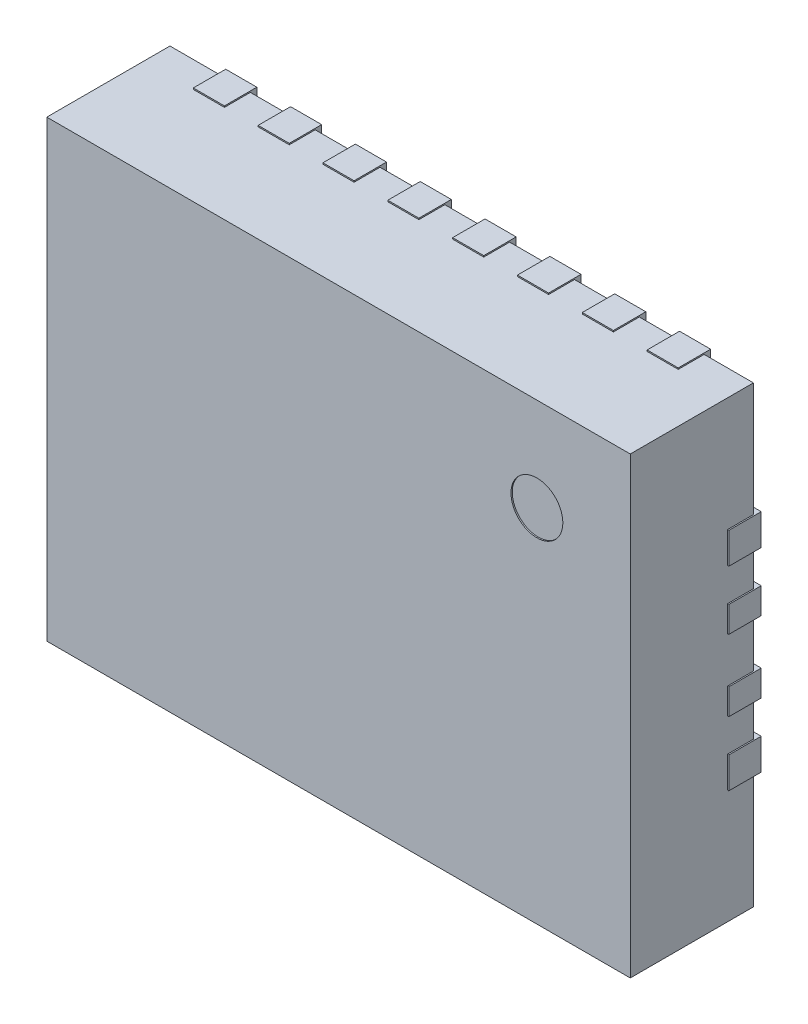
from build123d import *

# Parameters (mm, degrees)
SKETCH1_W                = 4.5
SKETCH1_H                = 3.5
BOSS_EXTRUDE1_DEPTH      = 0.95
SKETCH2_R                = 0.2
CUT_EXTRUDE1_DEPTH       = 0.01
BOSS_EXTRUDE2_DEPTH      = 0.05
BOSS_EXTRUDE2_DEPTH_BACK = 0.2
SKETCH3_W                = 0.01
SKETCH3_H                = 0.2
BOSS_EXTRUDE3_START      = -0.2
BOSS_EXTRUDE3_DEPTH      = 0.25
LPATTERN1_COUNT          = 2
LPATTERN1_PITCH          = 1.5
MIRROR1_START            = -0.2
MIRROR1_COPY_1_DEPTH     = 0.25
BOSS_EXTRUDE4_START      = -0.2
BOSS_EXTRUDE4_DEPTH      = 0.25
LPATTERN2_COUNT          = 8
LPATTERN2_PITCH          = 0.5
MIRROR2_START            = -0.2
MIRROR2_COPY_1_DEPTH     = 0.25
MIRROR2_COPY_2_DEPTH     = 0.25
MIRROR2_COPY_3_DEPTH     = 0.25
MIRROR2_COPY_4_DEPTH     = 0.25
MIRROR2_COPY_5_DEPTH     = 0.25
MIRROR2_COPY_6_DEPTH     = 0.25
MIRROR2_COPY_7_DEPTH     = 0.25


with BuildPart() as part:
    # Sketch1 → Boss-Extrude1 (new body)
    with BuildSketch(Plane.XY):
        Rectangle(SKETCH1_W, SKETCH1_H)
    extrude(amount=BOSS_EXTRUDE1_DEPTH)

    # Sketch2 → Cut-Extrude1 (cut)
    with BuildSketch(Plane.XY.offset(0.95)):
        with Locations((1.53, 1.03)):
            Circle(SKETCH2_R)
    extrude(amount=-CUT_EXTRUDE1_DEPTH, mode=Mode.SUBTRACT)

    # Sketch3 → Boss-Extrude2 (add, two sides: drawn at the far end of the back side and taken through both)
    with BuildSketch(Plane(origin=(0, 0, 0), x_dir=(-1, 0, 0), z_dir=(0, 0, -1)).offset(-BOSS_EXTRUDE2_DEPTH_BACK)):
        with BuildLine():
            Line((2.25, 0.375), (1.525, 0.375))
            Line((1.525, 0.375), (1.525, 0.9995))
            ThreePointArc((1.525, 0.9995), (1.517531223, 1.017531223), (1.4995, 1.025))
            Line((1.4995, 1.025), (-1.175, 1.025))
            Line((-1.175, 1.025), (-1.525, 0.675))
            Line((-1.525, 0.675), (-1.525, 0.375))
            Line((-1.525, 0.375), (-2.25, 0.375))
            Line((-2.25, 0.375), (-2.25, 0.175))
            Line((-2.25, 0.175), (-1.87, 0.175))
            Line((-1.87, 0.175), (-1.87, -0.175))
            Line((-1.87, -0.175), (-2.25, -0.175))
            Line((-2.25, -0.175), (-2.25, -0.375))
            Line((-2.25, -0.375), (-1.525, -0.375))
            Line((-1.525, -0.375), (-1.525, -0.9995))
            ThreePointArc((-1.525, -0.9995), (-1.517531223, -1.017531223), (-1.4995, -1.025))
            Line((-1.4995, -1.025), (1.4995, -1.025))
            ThreePointArc((1.4995, -1.025), (1.517531223, -1.017531223), (1.525, -0.9995))
            Line((1.525, -0.9995), (1.525, -0.375))
            Line((1.525, -0.375), (2.25, -0.375))
            Line((2.25, -0.375), (2.25, -0.175))
            Line((2.25, -0.175), (1.87, -0.175))
            Line((1.87, -0.175), (1.87, 0.175))
            Line((1.87, 0.175), (2.25, 0.175))
            Line((2.25, 0.175), (2.25, 0.375))
        make_face()
        with Locations((2.255, 0.275)):
            Rectangle(SKETCH3_W, SKETCH3_H)
        with Locations((2.255, -0.275)):
            Rectangle(SKETCH3_W, SKETCH3_H)
        with Locations((-2.255, -0.275)):
            Rectangle(SKETCH3_W, SKETCH3_H)
        with Locations((-2.255, 0.275)):
            Rectangle(SKETCH3_W, SKETCH3_H)
    extrude(amount=BOSS_EXTRUDE2_DEPTH + BOSS_EXTRUDE2_DEPTH_BACK)

    # Sketch5 → Boss-Extrude3 (add)
    with BuildSketch(Plane(origin=(0, 0, 0), x_dir=(-1, 0, 0), z_dir=(0, 0, -1)).offset(BOSS_EXTRUDE3_START)):
        with BuildLine():
            Line((1.97, 0.87), (2.25, 0.87))
            Line((2.25, 0.87), (2.26, 0.87))
            Line((2.26, 0.87), (2.26, 0.63))
            Line((2.26, 0.63), (2.25, 0.63))
            Line((2.25, 0.63), (1.97, 0.63))
            ThreePointArc((1.97, 0.63), (1.85, 0.75), (1.97, 0.87))
        make_face()
    boss_extrude3 = extrude(amount=BOSS_EXTRUDE3_DEPTH)

    # LPattern1: Boss-Extrude3 ×2
    with Locations(*[(0, -i * LPATTERN1_PITCH, 0) for i in range(1, LPATTERN1_COUNT)]):
        add(boss_extrude3)

    # Mirror1: Boss-Extrude3 across plane
    add(boss_extrude3.mirror(Plane(origin=(0, 0, 0), x_dir=(0, 0, 1), z_dir=(1, 0, 0))))

    # Mirror1 copy 1 sketch → Mirror1 copy 1 (add)
    with BuildSketch(Plane(origin=(0, -1.5, 0), x_dir=(1, 0, 0), z_dir=(0, 0, -1)).offset(MIRROR1_START)):
        with BuildLine():
            Line((1.97, -0.87), (2.25, -0.87))
            Line((2.25, -0.87), (2.26, -0.87))
            Line((2.26, -0.87), (2.26, -0.63))
            Line((2.26, -0.63), (2.25, -0.63))
            Line((2.25, -0.63), (1.97, -0.63))
            ThreePointArc((1.97, -0.63), (1.85, -0.75), (1.97, -0.87))
        make_face()
    extrude(amount=MIRROR1_COPY_1_DEPTH)

    # Sketch6 → Boss-Extrude4 (add)
    with BuildSketch(Plane(origin=(0, 0, 0), x_dir=(-1, 0, 0), z_dir=(0, 0, -1)).offset(BOSS_EXTRUDE4_START)):
        with BuildLine():
            Line((-1.87, 1.76), (-1.63, 1.76))
            Line((-1.63, 1.76), (-1.63, 1.75))
            Line((-1.63, 1.75), (-1.63, 1.47))
            ThreePointArc((-1.63, 1.47), (-1.75, 1.35), (-1.87, 1.47))
            Line((-1.87, 1.47), (-1.87, 1.75))
            Line((-1.87, 1.75), (-1.87, 1.76))
        make_face()
    boss_extrude4 = extrude(amount=BOSS_EXTRUDE4_DEPTH)

    # LPattern2: Boss-Extrude4 ×8
    with Locations(*[(-i * LPATTERN2_PITCH, 0, 0) for i in range(1, LPATTERN2_COUNT)]):
        add(boss_extrude4)

    # Mirror2: Boss-Extrude4 across plane
    add(boss_extrude4.mirror(Plane.ZX))

    # Mirror2 copy 1 sketch → Mirror2 copy 1 (add)
    with BuildSketch(Plane(origin=(-0.5, 0, 0), x_dir=(-1, 0, 0), z_dir=(0, 0, -1)).offset(MIRROR2_START)):
        with BuildLine():
            Line((-1.87, -1.76), (-1.63, -1.76))
            Line((-1.63, -1.76), (-1.63, -1.75))
            Line((-1.63, -1.75), (-1.63, -1.47))
            ThreePointArc((-1.63, -1.47), (-1.75, -1.35), (-1.87, -1.47))
            Line((-1.87, -1.47), (-1.87, -1.75))
            Line((-1.87, -1.75), (-1.87, -1.76))
        make_face()
    extrude(amount=MIRROR2_COPY_1_DEPTH)

    # Mirror2 copy 2 sketch → Mirror2 copy 2 (add)
    with BuildSketch(Plane(origin=(-1, 0, 0), x_dir=(-1, 0, 0), z_dir=(0, 0, -1)).offset(MIRROR2_START)):
        with BuildLine():
            Line((-1.87, -1.76), (-1.63, -1.76))
            Line((-1.63, -1.76), (-1.63, -1.75))
            Line((-1.63, -1.75), (-1.63, -1.47))
            ThreePointArc((-1.63, -1.47), (-1.75, -1.35), (-1.87, -1.47))
            Line((-1.87, -1.47), (-1.87, -1.75))
            Line((-1.87, -1.75), (-1.87, -1.76))
        make_face()
    extrude(amount=MIRROR2_COPY_2_DEPTH)

    # Mirror2 copy 3 sketch → Mirror2 copy 3 (add)
    with BuildSketch(Plane(origin=(-1.5, 0, 0), x_dir=(-1, 0, 0), z_dir=(0, 0, -1)).offset(MIRROR2_START)):
        with BuildLine():
            Line((-1.87, -1.76), (-1.63, -1.76))
            Line((-1.63, -1.76), (-1.63, -1.75))
            Line((-1.63, -1.75), (-1.63, -1.47))
            ThreePointArc((-1.63, -1.47), (-1.75, -1.35), (-1.87, -1.47))
            Line((-1.87, -1.47), (-1.87, -1.75))
            Line((-1.87, -1.75), (-1.87, -1.76))
        make_face()
    extrude(amount=MIRROR2_COPY_3_DEPTH)

    # Mirror2 copy 4 sketch → Mirror2 copy 4 (add)
    with BuildSketch(Plane(origin=(-2, 0, 0), x_dir=(-1, 0, 0), z_dir=(0, 0, -1)).offset(MIRROR2_START)):
        with BuildLine():
            Line((-1.87, -1.76), (-1.63, -1.76))
            Line((-1.63, -1.76), (-1.63, -1.75))
            Line((-1.63, -1.75), (-1.63, -1.47))
            ThreePointArc((-1.63, -1.47), (-1.75, -1.35), (-1.87, -1.47))
            Line((-1.87, -1.47), (-1.87, -1.75))
            Line((-1.87, -1.75), (-1.87, -1.76))
        make_face()
    extrude(amount=MIRROR2_COPY_4_DEPTH)

    # Mirror2 copy 5 sketch → Mirror2 copy 5 (add)
    with BuildSketch(Plane(origin=(-2.5, 0, 0), x_dir=(-1, 0, 0), z_dir=(0, 0, -1)).offset(MIRROR2_START)):
        with BuildLine():
            Line((-1.87, -1.76), (-1.63, -1.76))
            Line((-1.63, -1.76), (-1.63, -1.75))
            Line((-1.63, -1.75), (-1.63, -1.47))
            ThreePointArc((-1.63, -1.47), (-1.75, -1.35), (-1.87, -1.47))
            Line((-1.87, -1.47), (-1.87, -1.75))
            Line((-1.87, -1.75), (-1.87, -1.76))
        make_face()
    extrude(amount=MIRROR2_COPY_5_DEPTH)

    # Mirror2 copy 6 sketch → Mirror2 copy 6 (add)
    with BuildSketch(Plane(origin=(-3, 0, 0), x_dir=(-1, 0, 0), z_dir=(0, 0, -1)).offset(MIRROR2_START)):
        with BuildLine():
            Line((-1.87, -1.76), (-1.63, -1.76))
            Line((-1.63, -1.76), (-1.63, -1.75))
            Line((-1.63, -1.75), (-1.63, -1.47))
            ThreePointArc((-1.63, -1.47), (-1.75, -1.35), (-1.87, -1.47))
            Line((-1.87, -1.47), (-1.87, -1.75))
            Line((-1.87, -1.75), (-1.87, -1.76))
        make_face()
    extrude(amount=MIRROR2_COPY_6_DEPTH)

    # Mirror2 copy 7 sketch → Mirror2 copy 7 (add)
    with BuildSketch(Plane(origin=(-3.5, 0, 0), x_dir=(-1, 0, 0), z_dir=(0, 0, -1)).offset(MIRROR2_START)):
        with BuildLine():
            Line((-1.87, -1.76), (-1.63, -1.76))
            Line((-1.63, -1.76), (-1.63, -1.75))
            Line((-1.63, -1.75), (-1.63, -1.47))
            ThreePointArc((-1.63, -1.47), (-1.75, -1.35), (-1.87, -1.47))
            Line((-1.87, -1.47), (-1.87, -1.75))
            Line((-1.87, -1.75), (-1.87, -1.76))
        make_face()
    extrude(amount=MIRROR2_COPY_7_DEPTH)


solid = part.part
